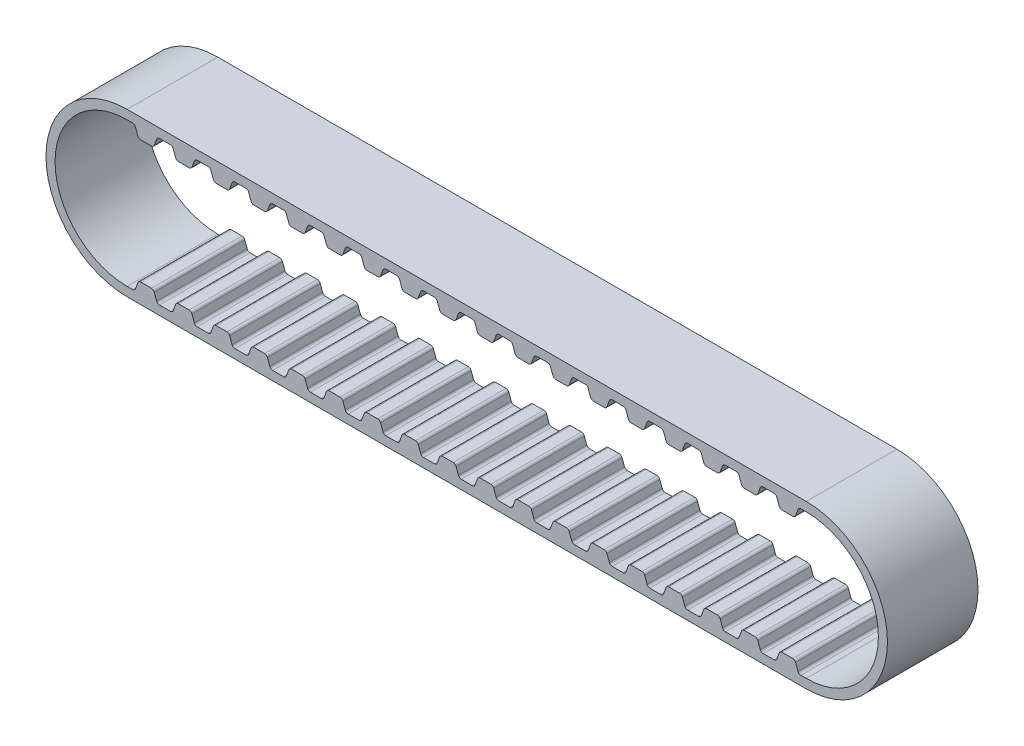
from build123d import *

# Parameters (mm, degrees)
AUFSATZ_LINEAR_AUSTRAGEN1_DEPTH = 6


with BuildPart() as part:
    # Skizze1 → Aufsatz-Linear austragen1 (new body)
    with BuildSketch(Plane.XY):
        with BuildLine():
            Line((0, 0), (45, 0))
            ThreePointArc((45, 0), (50.38, 5.38), (45, 10.76))
            Line((45, 10.76), (0, 10.76))
            ThreePointArc((0, 10.76), (-5.38, 5.38), (0, 0))
        make_face()
        with BuildLine():
            Line((0.706882147, 1.168404029), (0.547897017, 0.731595971))
            ThreePointArc((0.547897017, 0.731595971), (0.47467378, 0.636169591), (0.359958492, 0.6))
            Line((0.359958492, 0.6), (0, 0.6))
            ThreePointArc((0, 0.6), (-4.78, 5.38), (0, 10.16))
            Line((0, 10.16), (0.359958492, 10.16))
            ThreePointArc((0.359958492, 10.16), (0.47467378, 10.123830409), (0.547897017, 10.028404029))
            Line((0.547897017, 10.028404029), (0.706882147, 9.591595971))
            ThreePointArc((0.706882147, 9.591595971), (0.780105384, 9.496169591), (0.894820672, 9.46))
            Line((0.894820672, 9.46), (1.605179328, 9.46))
            ThreePointArc((1.605179328, 9.46), (1.719894616, 9.496169591), (1.793117853, 9.591595971))
            Line((1.793117853, 9.591595971), (1.952102983, 10.028404029))
            ThreePointArc((1.952102983, 10.028404029), (2.02532622, 10.123830409), (2.140041508, 10.16))
            Line((2.140041508, 10.16), (2.859958492, 10.16))
            ThreePointArc((2.859958492, 10.16), (2.97467378, 10.123830409), (3.047897017, 10.028404029))
            Line((3.047897017, 10.028404029), (3.206882147, 9.591595971))
            ThreePointArc((3.206882147, 9.591595971), (3.280105384, 9.496169591), (3.394820672, 9.46))
            Line((3.394820672, 9.46), (4.105179328, 9.46))
            ThreePointArc((4.105179328, 9.46), (4.219894616, 9.496169591), (4.293117853, 9.591595971))
            Line((4.293117853, 9.591595971), (4.452102983, 10.028404029))
            ThreePointArc((4.452102983, 10.028404029), (4.52532622, 10.123830409), (4.640041508, 10.16))
            Line((4.640041508, 10.16), (5.359958492, 10.16))
            ThreePointArc((5.359958492, 10.16), (5.47467378, 10.123830409), (5.547897017, 10.028404029))
            Line((5.547897017, 10.028404029), (5.706882147, 9.591595971))
            ThreePointArc((5.706882147, 9.591595971), (5.780105384, 9.496169591), (5.894820672, 9.46))
            Line((5.894820672, 9.46), (6.605179328, 9.46))
            ThreePointArc((6.605179328, 9.46), (6.719894616, 9.496169591), (6.793117853, 9.591595971))
            Line((6.793117853, 9.591595971), (6.952102983, 10.028404029))
            ThreePointArc((6.952102983, 10.028404029), (7.02532622, 10.123830409), (7.140041508, 10.16))
            Line((7.140041508, 10.16), (7.859958492, 10.16))
            ThreePointArc((7.859958492, 10.16), (7.97467378, 10.123830409), (8.047897017, 10.028404029))
            Line((8.047897017, 10.028404029), (8.206882147, 9.591595971))
            ThreePointArc((8.206882147, 9.591595971), (8.280105384, 9.496169591), (8.394820672, 9.46))
            Line((8.394820672, 9.46), (9.105179328, 9.46))
            ThreePointArc((9.105179328, 9.46), (9.219894616, 9.496169591), (9.293117853, 9.591595971))
            Line((9.293117853, 9.591595971), (9.452102983, 10.028404029))
            ThreePointArc((9.452102983, 10.028404029), (9.52532622, 10.123830409), (9.640041508, 10.16))
            Line((9.640041508, 10.16), (10.359958492, 10.16))
            ThreePointArc((10.359958492, 10.16), (10.47467378, 10.123830409), (10.547897017, 10.028404029))
            Line((10.547897017, 10.028404029), (10.706882147, 9.591595971))
            ThreePointArc((10.706882147, 9.591595971), (10.780105384, 9.496169591), (10.894820672, 9.46))
            Line((10.894820672, 9.46), (11.605179328, 9.46))
            ThreePointArc((11.605179328, 9.46), (11.719894616, 9.496169591), (11.793117853, 9.591595971))
            Line((11.793117853, 9.591595971), (11.952102983, 10.028404029))
            ThreePointArc((11.952102983, 10.028404029), (12.02532622, 10.123830409), (12.140041508, 10.16))
            Line((12.140041508, 10.16), (12.859958492, 10.16))
            ThreePointArc((12.859958492, 10.16), (12.97467378, 10.123830409), (13.047897017, 10.028404029))
            Line((13.047897017, 10.028404029), (13.206882147, 9.591595971))
            ThreePointArc((13.206882147, 9.591595971), (13.280105384, 9.496169591), (13.394820672, 9.46))
            Line((13.394820672, 9.46), (14.105179328, 9.46))
            ThreePointArc((14.105179328, 9.46), (14.219894616, 9.496169591), (14.293117853, 9.591595971))
            Line((14.293117853, 9.591595971), (14.452102983, 10.028404029))
            ThreePointArc((14.452102983, 10.028404029), (14.52532622, 10.123830409), (14.640041508, 10.16))
            Line((14.640041508, 10.16), (15.359958492, 10.16))
            ThreePointArc((15.359958492, 10.16), (15.47467378, 10.123830409), (15.547897017, 10.028404029))
            Line((15.547897017, 10.028404029), (15.706882147, 9.591595971))
            ThreePointArc((15.706882147, 9.591595971), (15.780105384, 9.496169591), (15.894820672, 9.46))
            Line((15.894820672, 9.46), (16.605179328, 9.46))
            ThreePointArc((16.605179328, 9.46), (16.719894616, 9.496169591), (16.793117853, 9.591595971))
            Line((16.793117853, 9.591595971), (16.952102983, 10.028404029))
            ThreePointArc((16.952102983, 10.028404029), (17.02532622, 10.123830409), (17.140041508, 10.16))
            Line((17.140041508, 10.16), (17.859958492, 10.16))
            ThreePointArc((17.859958492, 10.16), (17.97467378, 10.123830409), (18.047897017, 10.028404029))
            Line((18.047897017, 10.028404029), (18.206882147, 9.591595971))
            ThreePointArc((18.206882147, 9.591595971), (18.280105384, 9.496169591), (18.394820672, 9.46))
            Line((18.394820672, 9.46), (19.105179328, 9.46))
            ThreePointArc((19.105179328, 9.46), (19.219894616, 9.496169591), (19.293117853, 9.591595971))
            Line((19.293117853, 9.591595971), (19.452102983, 10.028404029))
            ThreePointArc((19.452102983, 10.028404029), (19.52532622, 10.123830409), (19.640041508, 10.16))
            Line((19.640041508, 10.16), (20.359958492, 10.16))
            ThreePointArc((20.359958492, 10.16), (20.47467378, 10.123830409), (20.547897017, 10.028404029))
            Line((20.547897017, 10.028404029), (20.706882147, 9.591595971))
            ThreePointArc((20.706882147, 9.591595971), (20.780105384, 9.496169591), (20.894820672, 9.46))
            Line((20.894820672, 9.46), (21.605179328, 9.46))
            ThreePointArc((21.605179328, 9.46), (21.719894616, 9.496169591), (21.793117853, 9.591595971))
            Line((21.793117853, 9.591595971), (21.952102983, 10.028404029))
            ThreePointArc((21.952102983, 10.028404029), (22.02532622, 10.123830409), (22.140041508, 10.16))
            Line((22.140041508, 10.16), (22.859958492, 10.16))
            ThreePointArc((22.859958492, 10.16), (22.97467378, 10.123830409), (23.047897017, 10.028404029))
            Line((23.047897017, 10.028404029), (23.206882147, 9.591595971))
            ThreePointArc((23.206882147, 9.591595971), (23.280105384, 9.496169591), (23.394820672, 9.46))
            Line((23.394820672, 9.46), (24.105179328, 9.46))
            ThreePointArc((24.105179328, 9.46), (24.219894616, 9.496169591), (24.293117853, 9.591595971))
            Line((24.293117853, 9.591595971), (24.452102983, 10.028404029))
            ThreePointArc((24.452102983, 10.028404029), (24.52532622, 10.123830409), (24.640041508, 10.16))
            Line((24.640041508, 10.16), (25.359958492, 10.16))
            ThreePointArc((25.359958492, 10.16), (25.47467378, 10.123830409), (25.547897017, 10.028404029))
            Line((25.547897017, 10.028404029), (25.706882147, 9.591595971))
            ThreePointArc((25.706882147, 9.591595971), (25.780105384, 9.496169591), (25.894820672, 9.46))
            Line((25.894820672, 9.46), (26.605179328, 9.46))
            ThreePointArc((26.605179328, 9.46), (26.719894616, 9.496169591), (26.793117853, 9.591595971))
            Line((26.793117853, 9.591595971), (26.952102983, 10.028404029))
            ThreePointArc((26.952102983, 10.028404029), (27.02532622, 10.123830409), (27.140041508, 10.16))
            Line((27.140041508, 10.16), (27.859958492, 10.16))
            ThreePointArc((27.859958492, 10.16), (27.97467378, 10.123830409), (28.047897017, 10.028404029))
            Line((28.047897017, 10.028404029), (28.206882147, 9.591595971))
            ThreePointArc((28.206882147, 9.591595971), (28.280105384, 9.496169591), (28.394820672, 9.46))
            Line((28.394820672, 9.46), (29.105179328, 9.46))
            ThreePointArc((29.105179328, 9.46), (29.219894616, 9.496169591), (29.293117853, 9.591595971))
            Line((29.293117853, 9.591595971), (29.452102983, 10.028404029))
            ThreePointArc((29.452102983, 10.028404029), (29.52532622, 10.123830409), (29.640041508, 10.16))
            Line((29.640041508, 10.16), (30.359958492, 10.16))
            ThreePointArc((30.359958492, 10.16), (30.47467378, 10.123830409), (30.547897017, 10.028404029))
            Line((30.547897017, 10.028404029), (30.706882147, 9.591595971))
            ThreePointArc((30.706882147, 9.591595971), (30.780105384, 9.496169591), (30.894820672, 9.46))
            Line((30.894820672, 9.46), (31.605179328, 9.46))
            ThreePointArc((31.605179328, 9.46), (31.719894616, 9.496169591), (31.793117853, 9.591595971))
            Line((31.793117853, 9.591595971), (31.952102983, 10.028404029))
            ThreePointArc((31.952102983, 10.028404029), (32.02532622, 10.123830409), (32.140041508, 10.16))
            Line((32.140041508, 10.16), (32.859958492, 10.16))
            ThreePointArc((32.859958492, 10.16), (32.97467378, 10.123830409), (33.047897017, 10.028404029))
            Line((33.047897017, 10.028404029), (33.206882147, 9.591595971))
            ThreePointArc((33.206882147, 9.591595971), (33.280105384, 9.496169591), (33.394820672, 9.46))
            Line((33.394820672, 9.46), (34.105179328, 9.46))
            ThreePointArc((34.105179328, 9.46), (34.219894616, 9.496169591), (34.293117853, 9.591595971))
            Line((34.293117853, 9.591595971), (34.452102983, 10.028404029))
            ThreePointArc((34.452102983, 10.028404029), (34.52532622, 10.123830409), (34.640041508, 10.16))
            Line((34.640041508, 10.16), (35.359958492, 10.16))
            ThreePointArc((35.359958492, 10.16), (35.47467378, 10.123830409), (35.547897017, 10.028404029))
            Line((35.547897017, 10.028404029), (35.706882147, 9.591595971))
            ThreePointArc((35.706882147, 9.591595971), (35.780105384, 9.496169591), (35.894820672, 9.46))
            Line((35.894820672, 9.46), (36.605179328, 9.46))
            ThreePointArc((36.605179328, 9.46), (36.719894616, 9.496169591), (36.793117853, 9.591595971))
            Line((36.793117853, 9.591595971), (36.952102983, 10.028404029))
            ThreePointArc((36.952102983, 10.028404029), (37.02532622, 10.123830409), (37.140041508, 10.16))
            Line((37.140041508, 10.16), (37.859958492, 10.16))
            ThreePointArc((37.859958492, 10.16), (37.97467378, 10.123830409), (38.047897017, 10.028404029))
            Line((38.047897017, 10.028404029), (38.206882147, 9.591595971))
            ThreePointArc((38.206882147, 9.591595971), (38.280105384, 9.496169591), (38.394820672, 9.46))
            Line((38.394820672, 9.46), (39.105179328, 9.46))
            ThreePointArc((39.105179328, 9.46), (39.219894616, 9.496169591), (39.293117853, 9.591595971))
            Line((39.293117853, 9.591595971), (39.452102983, 10.028404029))
            ThreePointArc((39.452102983, 10.028404029), (39.52532622, 10.123830409), (39.640041508, 10.16))
            Line((39.640041508, 10.16), (40.359958492, 10.16))
            ThreePointArc((40.359958492, 10.16), (40.47467378, 10.123830409), (40.547897017, 10.028404029))
            Line((40.547897017, 10.028404029), (40.706882147, 9.591595971))
            ThreePointArc((40.706882147, 9.591595971), (40.780105384, 9.496169591), (40.894820672, 9.46))
            Line((40.894820672, 9.46), (41.605179328, 9.46))
            ThreePointArc((41.605179328, 9.46), (41.719894616, 9.496169591), (41.793117853, 9.591595971))
            Line((41.793117853, 9.591595971), (41.952102983, 10.028404029))
            ThreePointArc((41.952102983, 10.028404029), (42.02532622, 10.123830409), (42.140041508, 10.16))
            Line((42.140041508, 10.16), (42.859958492, 10.16))
            ThreePointArc((42.859958492, 10.16), (42.97467378, 10.123830409), (43.047897017, 10.028404029))
            Line((43.047897017, 10.028404029), (43.206882147, 9.591595971))
            ThreePointArc((43.206882147, 9.591595971), (43.280105384, 9.496169591), (43.394820672, 9.46))
            Line((43.394820672, 9.46), (44.105179328, 9.46))
            ThreePointArc((44.105179328, 9.46), (44.219894616, 9.496169591), (44.293117853, 9.591595971))
            Line((44.293117853, 9.591595971), (44.452102983, 10.028404029))
            ThreePointArc((44.452102983, 10.028404029), (44.52532622, 10.123830409), (44.640041508, 10.16))
            Line((44.640041508, 10.16), (45, 10.16))
            ThreePointArc((45, 10.16), (49.78, 5.38), (45, 0.6))
            Line((45, 0.6), (44.640041508, 0.6))
            ThreePointArc((44.640041508, 0.6), (44.52532622, 0.636169591), (44.452102983, 0.731595971))
            Line((44.452102983, 0.731595971), (44.293117853, 1.168404029))
            ThreePointArc((44.293117853, 1.168404029), (44.219894616, 1.263830409), (44.105179328, 1.3))
            Line((44.105179328, 1.3), (43.394820672, 1.3))
            ThreePointArc((43.394820672, 1.3), (43.280105384, 1.263830409), (43.206882147, 1.168404029))
            Line((43.206882147, 1.168404029), (43.047897017, 0.731595971))
            ThreePointArc((43.047897017, 0.731595971), (42.97467378, 0.636169591), (42.859958492, 0.6))
            Line((42.859958492, 0.6), (42.140041508, 0.6))
            ThreePointArc((42.140041508, 0.6), (42.02532622, 0.636169591), (41.952102983, 0.731595971))
            Line((41.952102983, 0.731595971), (41.793117853, 1.168404029))
            ThreePointArc((41.793117853, 1.168404029), (41.719894616, 1.263830409), (41.605179328, 1.3))
            Line((41.605179328, 1.3), (40.894820672, 1.3))
            ThreePointArc((40.894820672, 1.3), (40.780105384, 1.263830409), (40.706882147, 1.168404029))
            Line((40.706882147, 1.168404029), (40.547897017, 0.731595971))
            ThreePointArc((40.547897017, 0.731595971), (40.47467378, 0.636169591), (40.359958492, 0.6))
            Line((40.359958492, 0.6), (39.640041508, 0.6))
            ThreePointArc((39.640041508, 0.6), (39.52532622, 0.636169591), (39.452102983, 0.731595971))
            Line((39.452102983, 0.731595971), (39.293117853, 1.168404029))
            ThreePointArc((39.293117853, 1.168404029), (39.219894616, 1.263830409), (39.105179328, 1.3))
            Line((39.105179328, 1.3), (38.394820672, 1.3))
            ThreePointArc((38.394820672, 1.3), (38.280105384, 1.263830409), (38.206882147, 1.168404029))
            Line((38.206882147, 1.168404029), (38.047897017, 0.731595971))
            ThreePointArc((38.047897017, 0.731595971), (37.97467378, 0.636169591), (37.859958492, 0.6))
            Line((37.859958492, 0.6), (37.140041508, 0.6))
            ThreePointArc((37.140041508, 0.6), (37.02532622, 0.636169591), (36.952102983, 0.731595971))
            Line((36.952102983, 0.731595971), (36.793117853, 1.168404029))
            ThreePointArc((36.793117853, 1.168404029), (36.719894616, 1.263830409), (36.605179328, 1.3))
            Line((36.605179328, 1.3), (35.894820672, 1.3))
            ThreePointArc((35.894820672, 1.3), (35.780105384, 1.263830409), (35.706882147, 1.168404029))
            Line((35.706882147, 1.168404029), (35.547897017, 0.731595971))
            ThreePointArc((35.547897017, 0.731595971), (35.47467378, 0.636169591), (35.359958492, 0.6))
            Line((35.359958492, 0.6), (34.640041508, 0.6))
            ThreePointArc((34.640041508, 0.6), (34.52532622, 0.636169591), (34.452102983, 0.731595971))
            Line((34.452102983, 0.731595971), (34.293117853, 1.168404029))
            ThreePointArc((34.293117853, 1.168404029), (34.219894616, 1.263830409), (34.105179328, 1.3))
            Line((34.105179328, 1.3), (33.394820672, 1.3))
            ThreePointArc((33.394820672, 1.3), (33.280105384, 1.263830409), (33.206882147, 1.168404029))
            Line((33.206882147, 1.168404029), (33.047897017, 0.731595971))
            ThreePointArc((33.047897017, 0.731595971), (32.97467378, 0.636169591), (32.859958492, 0.6))
            Line((32.859958492, 0.6), (32.140041508, 0.6))
            ThreePointArc((32.140041508, 0.6), (32.02532622, 0.636169591), (31.952102983, 0.731595971))
            Line((31.952102983, 0.731595971), (31.793117853, 1.168404029))
            ThreePointArc((31.793117853, 1.168404029), (31.719894616, 1.263830409), (31.605179328, 1.3))
            Line((31.605179328, 1.3), (30.894820672, 1.3))
            ThreePointArc((30.894820672, 1.3), (30.780105384, 1.263830409), (30.706882147, 1.168404029))
            Line((30.706882147, 1.168404029), (30.547897017, 0.731595971))
            ThreePointArc((30.547897017, 0.731595971), (30.47467378, 0.636169591), (30.359958492, 0.6))
            Line((30.359958492, 0.6), (29.640041508, 0.6))
            ThreePointArc((29.640041508, 0.6), (29.52532622, 0.636169591), (29.452102983, 0.731595971))
            Line((29.452102983, 0.731595971), (29.293117853, 1.168404029))
            ThreePointArc((29.293117853, 1.168404029), (29.219894616, 1.263830409), (29.105179328, 1.3))
            Line((29.105179328, 1.3), (28.394820672, 1.3))
            ThreePointArc((28.394820672, 1.3), (28.280105384, 1.263830409), (28.206882147, 1.168404029))
            Line((28.206882147, 1.168404029), (28.047897017, 0.731595971))
            ThreePointArc((28.047897017, 0.731595971), (27.97467378, 0.636169591), (27.859958492, 0.6))
            Line((27.859958492, 0.6), (27.140041508, 0.6))
            ThreePointArc((27.140041508, 0.6), (27.02532622, 0.636169591), (26.952102983, 0.731595971))
            Line((26.952102983, 0.731595971), (26.793117853, 1.168404029))
            ThreePointArc((26.793117853, 1.168404029), (26.719894616, 1.263830409), (26.605179328, 1.3))
            Line((26.605179328, 1.3), (25.894820672, 1.3))
            ThreePointArc((25.894820672, 1.3), (25.780105384, 1.263830409), (25.706882147, 1.168404029))
            Line((25.706882147, 1.168404029), (25.547897017, 0.731595971))
            ThreePointArc((25.547897017, 0.731595971), (25.47467378, 0.636169591), (25.359958492, 0.6))
            Line((25.359958492, 0.6), (24.640041508, 0.6))
            ThreePointArc((24.640041508, 0.6), (24.52532622, 0.636169591), (24.452102983, 0.731595971))
            Line((24.452102983, 0.731595971), (24.293117853, 1.168404029))
            ThreePointArc((24.293117853, 1.168404029), (24.219894616, 1.263830409), (24.105179328, 1.3))
            Line((24.105179328, 1.3), (23.394820672, 1.3))
            ThreePointArc((23.394820672, 1.3), (23.280105384, 1.263830409), (23.206882147, 1.168404029))
            Line((23.206882147, 1.168404029), (23.047897017, 0.731595971))
            ThreePointArc((23.047897017, 0.731595971), (22.97467378, 0.636169591), (22.859958492, 0.6))
            Line((22.859958492, 0.6), (22.140041508, 0.6))
            ThreePointArc((22.140041508, 0.6), (22.02532622, 0.636169591), (21.952102983, 0.731595971))
            Line((21.952102983, 0.731595971), (21.793117853, 1.168404029))
            ThreePointArc((21.793117853, 1.168404029), (21.719894616, 1.263830409), (21.605179328, 1.3))
            Line((21.605179328, 1.3), (20.894820672, 1.3))
            ThreePointArc((20.894820672, 1.3), (20.780105384, 1.263830409), (20.706882147, 1.168404029))
            Line((20.706882147, 1.168404029), (20.547897017, 0.731595971))
            ThreePointArc((20.547897017, 0.731595971), (20.47467378, 0.636169591), (20.359958492, 0.6))
            Line((20.359958492, 0.6), (19.640041508, 0.6))
            ThreePointArc((19.640041508, 0.6), (19.52532622, 0.636169591), (19.452102983, 0.731595971))
            Line((19.452102983, 0.731595971), (19.293117853, 1.168404029))
            ThreePointArc((19.293117853, 1.168404029), (19.219894616, 1.263830409), (19.105179328, 1.3))
            Line((19.105179328, 1.3), (18.394820672, 1.3))
            ThreePointArc((18.394820672, 1.3), (18.280105384, 1.263830409), (18.206882147, 1.168404029))
            Line((18.206882147, 1.168404029), (18.047897017, 0.731595971))
            ThreePointArc((18.047897017, 0.731595971), (17.97467378, 0.636169591), (17.859958492, 0.6))
            Line((17.859958492, 0.6), (17.140041508, 0.6))
            ThreePointArc((17.140041508, 0.6), (17.02532622, 0.636169591), (16.952102983, 0.731595971))
            Line((16.952102983, 0.731595971), (16.793117853, 1.168404029))
            ThreePointArc((16.793117853, 1.168404029), (16.719894616, 1.263830409), (16.605179328, 1.3))
            Line((16.605179328, 1.3), (15.894820672, 1.3))
            ThreePointArc((15.894820672, 1.3), (15.780105384, 1.263830409), (15.706882147, 1.168404029))
            Line((15.706882147, 1.168404029), (15.547897017, 0.731595971))
            ThreePointArc((15.547897017, 0.731595971), (15.47467378, 0.636169591), (15.359958492, 0.6))
            Line((15.359958492, 0.6), (14.640041508, 0.6))
            ThreePointArc((14.640041508, 0.6), (14.52532622, 0.636169591), (14.452102983, 0.731595971))
            Line((14.452102983, 0.731595971), (14.293117853, 1.168404029))
            ThreePointArc((14.293117853, 1.168404029), (14.219894616, 1.263830409), (14.105179328, 1.3))
            Line((14.105179328, 1.3), (13.394820672, 1.3))
            ThreePointArc((13.394820672, 1.3), (13.280105384, 1.263830409), (13.206882147, 1.168404029))
            Line((13.206882147, 1.168404029), (13.047897017, 0.731595971))
            ThreePointArc((13.047897017, 0.731595971), (12.97467378, 0.636169591), (12.859958492, 0.6))
            Line((12.859958492, 0.6), (12.140041508, 0.6))
            ThreePointArc((12.140041508, 0.6), (12.02532622, 0.636169591), (11.952102983, 0.731595971))
            Line((11.952102983, 0.731595971), (11.793117853, 1.168404029))
            ThreePointArc((11.793117853, 1.168404029), (11.719894616, 1.263830409), (11.605179328, 1.3))
            Line((11.605179328, 1.3), (10.894820672, 1.3))
            ThreePointArc((10.894820672, 1.3), (10.780105384, 1.263830409), (10.706882147, 1.168404029))
            Line((10.706882147, 1.168404029), (10.547897017, 0.731595971))
            ThreePointArc((10.547897017, 0.731595971), (10.47467378, 0.636169591), (10.359958492, 0.6))
            Line((10.359958492, 0.6), (9.640041508, 0.6))
            ThreePointArc((9.640041508, 0.6), (9.52532622, 0.636169591), (9.452102983, 0.731595971))
            Line((9.452102983, 0.731595971), (9.293117853, 1.168404029))
            ThreePointArc((9.293117853, 1.168404029), (9.219894616, 1.263830409), (9.105179328, 1.3))
            Line((9.105179328, 1.3), (8.394820672, 1.3))
            ThreePointArc((8.394820672, 1.3), (8.280105384, 1.263830409), (8.206882147, 1.168404029))
            Line((8.206882147, 1.168404029), (8.047897017, 0.731595971))
            ThreePointArc((8.047897017, 0.731595971), (7.97467378, 0.636169591), (7.859958492, 0.6))
            Line((7.859958492, 0.6), (7.140041508, 0.6))
            ThreePointArc((7.140041508, 0.6), (7.02532622, 0.636169591), (6.952102983, 0.731595971))
            Line((6.952102983, 0.731595971), (6.793117853, 1.168404029))
            ThreePointArc((6.793117853, 1.168404029), (6.719894616, 1.263830409), (6.605179328, 1.3))
            Line((6.605179328, 1.3), (5.894820672, 1.3))
            ThreePointArc((5.894820672, 1.3), (5.780105384, 1.263830409), (5.706882147, 1.168404029))
            Line((5.706882147, 1.168404029), (5.547897017, 0.731595971))
            ThreePointArc((5.547897017, 0.731595971), (5.47467378, 0.636169591), (5.359958492, 0.6))
            Line((5.359958492, 0.6), (4.640041508, 0.6))
            ThreePointArc((4.640041508, 0.6), (4.52532622, 0.636169591), (4.452102983, 0.731595971))
            Line((4.452102983, 0.731595971), (4.293117853, 1.168404029))
            ThreePointArc((4.293117853, 1.168404029), (4.219894616, 1.263830409), (4.105179328, 1.3))
            Line((4.105179328, 1.3), (3.394820672, 1.3))
            ThreePointArc((3.394820672, 1.3), (3.280105384, 1.263830409), (3.206882147, 1.168404029))
            Line((3.206882147, 1.168404029), (3.047897017, 0.731595971))
            ThreePointArc((3.047897017, 0.731595971), (2.97467378, 0.636169591), (2.859958492, 0.6))
            Line((2.859958492, 0.6), (2.140041508, 0.6))
            ThreePointArc((2.140041508, 0.6), (2.02532622, 0.636169591), (1.952102983, 0.731595971))
            Line((1.952102983, 0.731595971), (1.793117853, 1.168404029))
            ThreePointArc((1.793117853, 1.168404029), (1.719894616, 1.263830409), (1.605179328, 1.3))
            Line((1.605179328, 1.3), (0.894820672, 1.3))
            ThreePointArc((0.894820672, 1.3), (0.780105384, 1.263830409), (0.706882147, 1.168404029))
        make_face(mode=Mode.SUBTRACT)
    extrude(amount=-AUFSATZ_LINEAR_AUSTRAGEN1_DEPTH)


solid = part.part
